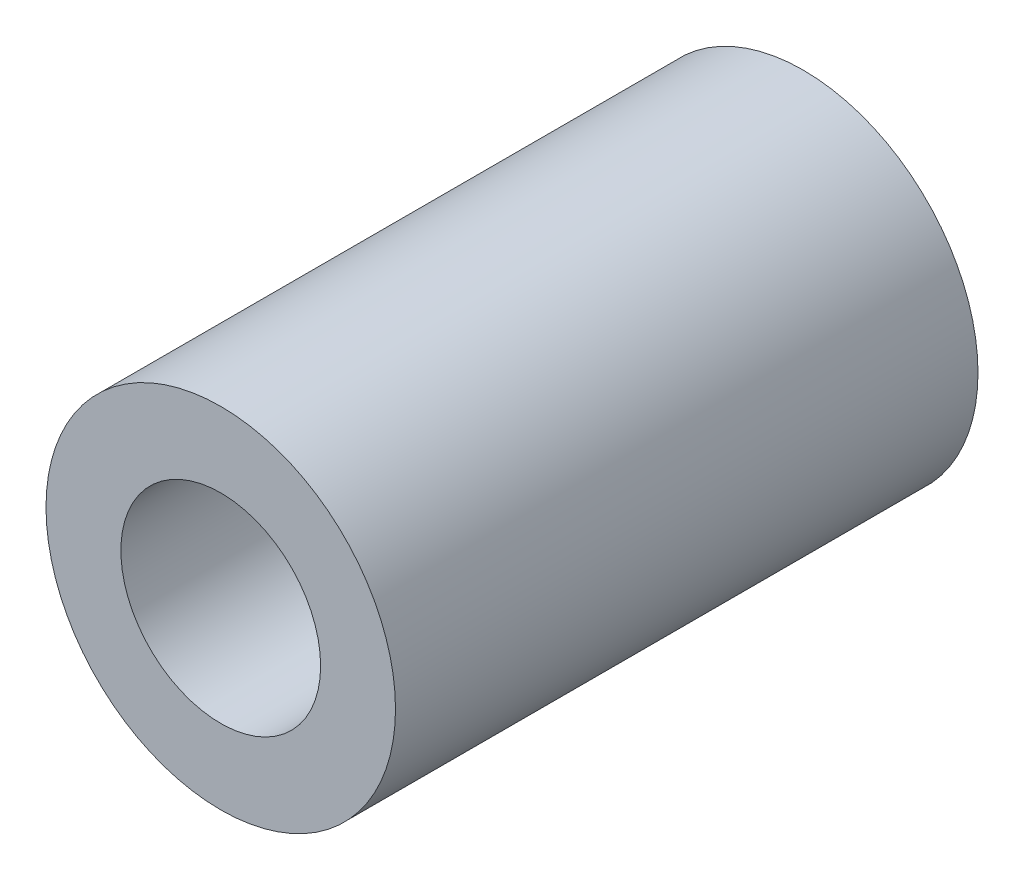
from build123d import *

# Parameters (mm, degrees)
SKETCH1_R           = 6
SKETCH1_R_2         = 3.429
BOSS_EXTRUDE1_DEPTH = 10


with BuildPart() as part:
    # Sketch1 → Boss-Extrude1 (new, symmetric)
    with BuildSketch(Plane.XY):
        Circle(SKETCH1_R)
        Circle(SKETCH1_R_2, mode=Mode.SUBTRACT)
    extrude(amount=BOSS_EXTRUDE1_DEPTH, both=True)


solid = part.part
